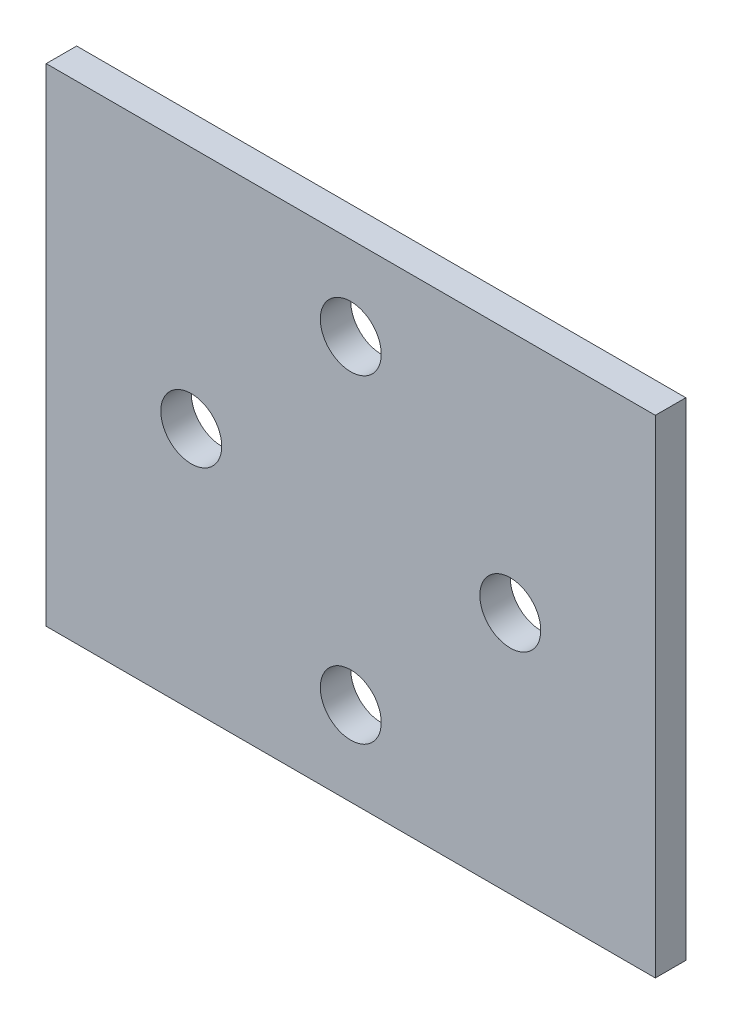
from build123d import *

# Parameters (mm, degrees)
SKETCH1_W           = 100
SKETCH1_H           = 80
SKETCH1_R           = 5
BOSS_EXTRUDE3_DEPTH = 5


with BuildPart() as part:
    # Sketch1 → Boss-Extrude3 (new body)
    with BuildSketch(Plane.XY):
        Rectangle(SKETCH1_W, SKETCH1_H)
        with Locations((-26.18590973, 0)):
            Circle(SKETCH1_R, mode=Mode.SUBTRACT)
        with Locations((0, 26.18590973)):
            Circle(SKETCH1_R, mode=Mode.SUBTRACT)
        with Locations((26.18590973, 0)):
            Circle(SKETCH1_R, mode=Mode.SUBTRACT)
        with Locations((0, -26.18590973)):
            Circle(SKETCH1_R, mode=Mode.SUBTRACT)
    extrude(amount=-BOSS_EXTRUDE3_DEPTH)


solid = part.part
